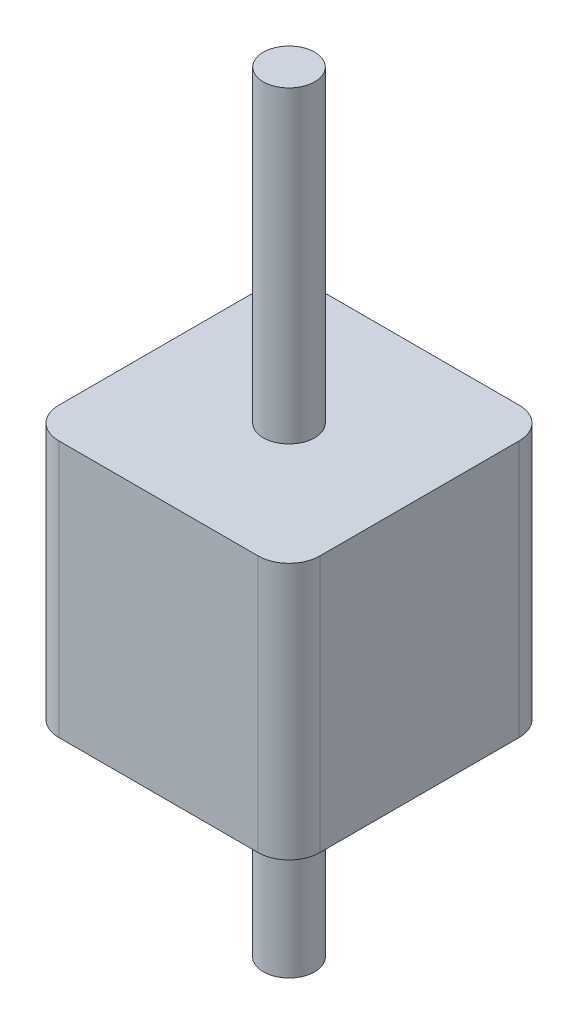
from build123d import *

# Parameters (mm, degrees)
BOSS_EXTRUDE1_DEPTH = 2.5
SKETCH2_R           = 0.25
BOSS_EXTRUDE2_DEPTH = 3
BOSS_EXTRUDE3_START = 2
SKETCH3_R           = 0.25
BOSS_EXTRUDE3_DEPTH = 2


with BuildPart() as part:
    # Sketch1 → Boss-Extrude1 (new body)
    with BuildSketch(Plane(origin=(0, 0, 0), x_dir=(1, 0, 0), z_dir=(0, 1, 0))):
        with BuildLine():
            Line((-0.97, -1.27), (0.97, -1.27))
            ThreePointArc((0.97, -1.27), (1.182132034, -1.182132034), (1.27, -0.97))
            Line((1.27, -0.97), (1.27, 0.97))
            ThreePointArc((1.27, 0.97), (1.182132034, 1.182132034), (0.97, 1.27))
            Line((0.97, 1.27), (-0.97, 1.27))
            ThreePointArc((-0.97, 1.27), (-1.182132034, 1.182132034), (-1.27, 0.97))
            Line((-1.27, 0.97), (-1.27, -0.97))
            ThreePointArc((-1.27, -0.97), (-1.182132034, -1.182132034), (-0.97, -1.27))
        make_face()
    extrude(amount=BOSS_EXTRUDE1_DEPTH)

    # Sketch2 → Boss-Extrude2 (add)
    with BuildSketch(Plane(origin=(0, 2.5, 0), x_dir=(1, 0, 0), z_dir=(0, 1, 0))):
        with Locations(Location((0, 0, 0), (0, 0, 270))):
            Circle(SKETCH2_R)
    extrude(amount=BOSS_EXTRUDE2_DEPTH)

    # Sketch3 → Boss-Extrude3 (add)
    with BuildSketch(Plane.XZ.offset(BOSS_EXTRUDE3_START)):
        with Locations(Location((0, 0, 0), (0, 0, 90))):
            Circle(SKETCH3_R)
    extrude(amount=-BOSS_EXTRUDE3_DEPTH)


solid = part.part
